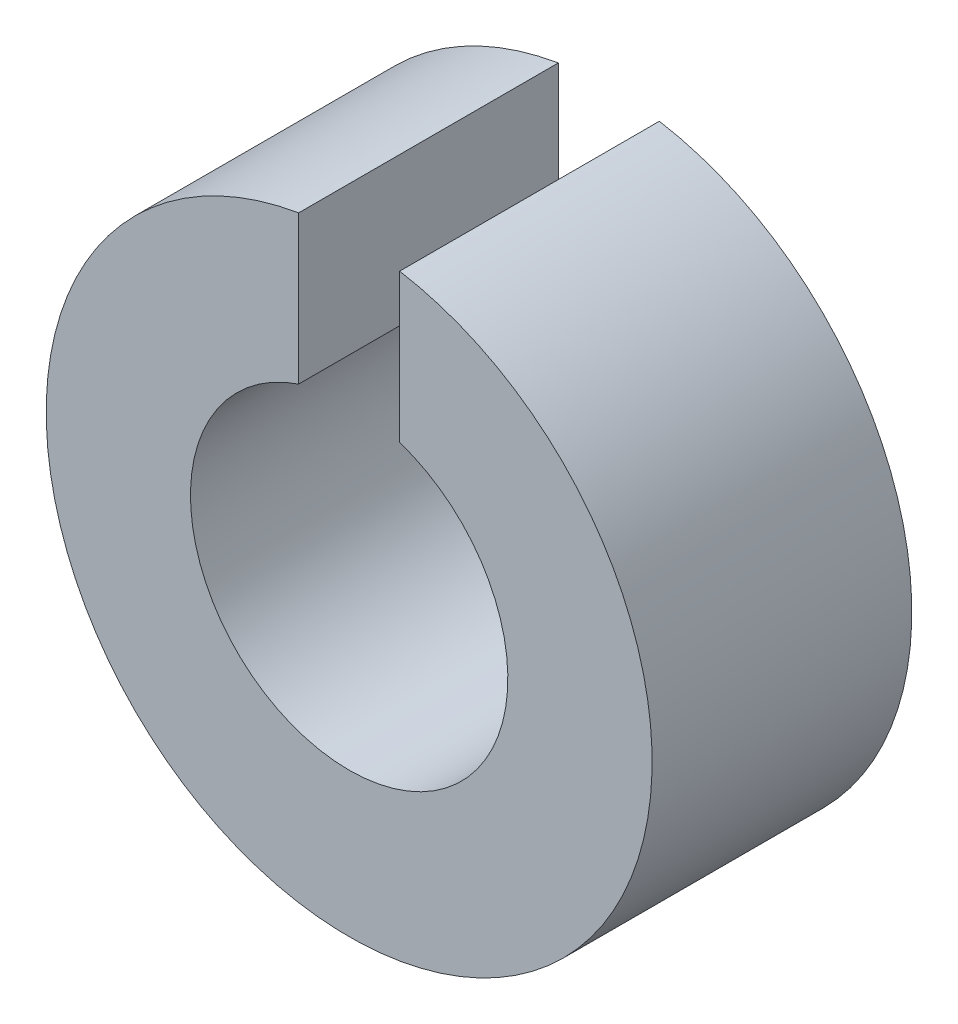
from build123d import *

# Parameters (mm, degrees)
SKETCH_1_R          = 10.5
SKETCH_1_R_2        = 5.5
EXTRUDE_1_DEPTH     = 9
SKETCH_2_W          = 3.5
SKETCH_2_H          = 15
CUT_EXTRUDE_1_DEPTH = 18.363755354


with BuildPart() as part:
    # Эскиз1 → Бобышка-Вытянуть1 (new body)
    with BuildSketch(Plane.XY):
        Circle(SKETCH_1_R)
        Circle(SKETCH_1_R_2, mode=Mode.SUBTRACT)
    extrude(amount=EXTRUDE_1_DEPTH)

    # Эскиз2 → Вырез-Вытянуть1 (cut, through all)
    with BuildSketch(Plane.XY.offset(9)):
        with Locations((0, 10.5)):
            Rectangle(SKETCH_2_W, SKETCH_2_H)
    extrude(amount=-CUT_EXTRUDE_1_DEPTH, mode=Mode.SUBTRACT)


solid = part.part
